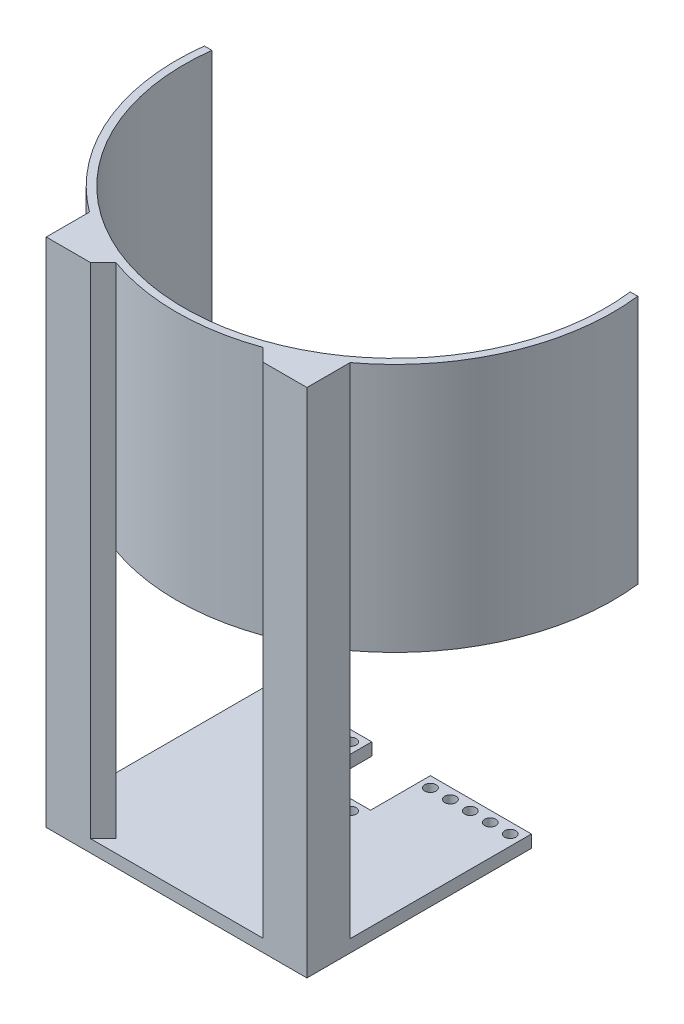
from build123d import *

# Parameters (mm, degrees)
SKETCH_2_R      = 2.25
EXTRUDE_1_DEPTH = 5
EXTRUDE_5_DEPTH = 100
EXTRUDE_START   = 100
EXTRUDE_7_DEPTH = 100


with BuildPart() as part:
    # 草图2 → 凸台-拉伸1 (new body)
    with BuildSketch(Plane(origin=(0, 0, 0), x_dir=(1, 0, 0), z_dir=(0, 1, 0))):
        Polygon((-11.75, 45), (-52.25, 45), (-52.25, -45), (52.25, -45), (52.25, 45), (11.75, 45), (11.75, 21), (-11.75, 21), align=None)
        with Locations(Location((-8, 16.75, 0), (0, 0, 270))):
            Circle(SKETCH_2_R, mode=Mode.SUBTRACT)
        with Locations(Location((-48, 40.75, 0), (0, 0, 270))):
            Circle(SKETCH_2_R, mode=Mode.SUBTRACT)
        with Locations(Location((-40, 40.75, 0), (0, 0, 270))):
            Circle(SKETCH_2_R, mode=Mode.SUBTRACT)
        with Locations(Location((-32, 40.75, 0), (0, 0, 270))):
            Circle(SKETCH_2_R, mode=Mode.SUBTRACT)
        with Locations(Location((-24, 40.75, 0), (0, 0, 270))):
            Circle(SKETCH_2_R, mode=Mode.SUBTRACT)
        with Locations(Location((-16, 40.75, 0), (0, 0, 270))):
            Circle(SKETCH_2_R, mode=Mode.SUBTRACT)
        with Locations(Location((0, 16.75, 0), (0, 0, 270))):
            Circle(SKETCH_2_R, mode=Mode.SUBTRACT)
        with Locations(Location((8, 16.75, 0), (0, 0, 270))):
            Circle(SKETCH_2_R, mode=Mode.SUBTRACT)
        with Locations(Location((16, 40.75, 0), (0, 0, 270))):
            Circle(SKETCH_2_R, mode=Mode.SUBTRACT)
        with Locations(Location((24, 40.75, 0), (0, 0, 270))):
            Circle(SKETCH_2_R, mode=Mode.SUBTRACT)
        with Locations(Location((32, 40.75, 0), (0, 0, 270))):
            Circle(SKETCH_2_R, mode=Mode.SUBTRACT)
        with Locations(Location((40, 40.75, 0), (0, 0, 270))):
            Circle(SKETCH_2_R, mode=Mode.SUBTRACT)
        with Locations(Location((48, 40.75, 0), (0, 0, 270))):
            Circle(SKETCH_2_R, mode=Mode.SUBTRACT)
    extrude(amount=EXTRUDE_1_DEPTH)

    # 草图7 → 凸台-拉伸5 (add)
    with BuildSketch(Plane(origin=(0, 5, 5), x_dir=(1, 0, 0), z_dir=(0, 1, 0))):
        with BuildLine():
            ThreePointArc((-29.462817643, -34.890487173), (-41.309546241, -29.634761226), (-52.25, -22.686804315))
            Line((-52.25, -22.686804315), (-52.25, -40))
            Line((-52.25, -40), (-34.57233047, -40))
            Line((-34.57233047, -40), (-29.462817643, -34.890487173))
        make_face()
        with BuildLine():
            ThreePointArc((52.25, -22.686804315), (41.309546241, -29.634761226), (29.462817643, -34.890487173))
            Line((29.462817643, -34.890487173), (34.57233047, -40))
            Line((34.57233047, -40), (52.25, -40))
            Line((52.25, -40), (52.25, -22.686804315))
        make_face()
    extrude(amount=EXTRUDE_5_DEPTH)

    # 草图7<5> → 凸台-拉伸7 (add)
    with BuildSketch(Plane(origin=(0, 5, 5), x_dir=(1, 0, 0), z_dir=(0, 1, 0)).offset(EXTRUDE_START)):
        with BuildLine():
            Line((52.25, -40), (52.25, -22.686804315))
            ThreePointArc((52.25, -22.686804315), (80.411596121, 13.000359287), (86.867715522, 58))
            Line((86.867715522, 58), (83.845095265, 58))
            ThreePointArc((83.845095265, 58), (0, -37), (-83.845095265, 58))
            Line((-83.845095265, 58), (-86.867715522, 58))
            ThreePointArc((-86.867715522, 58), (-80.411596121, 13.000359287), (-52.25, -22.686804315))
            Line((-52.25, -22.686804315), (-52.25, -40))
            Line((-52.25, -40), (-34.57233047, -40))
            Line((-34.57233047, -40), (-29.462817643, -34.890487173))
            ThreePointArc((-29.462817643, -34.890487173), (0, -40), (29.462817643, -34.890487173))
            Line((29.462817643, -34.890487173), (34.57233047, -40))
            Line((34.57233047, -40), (52.25, -40))
        make_face()
    extrude(amount=EXTRUDE_7_DEPTH)


solid = part.part
